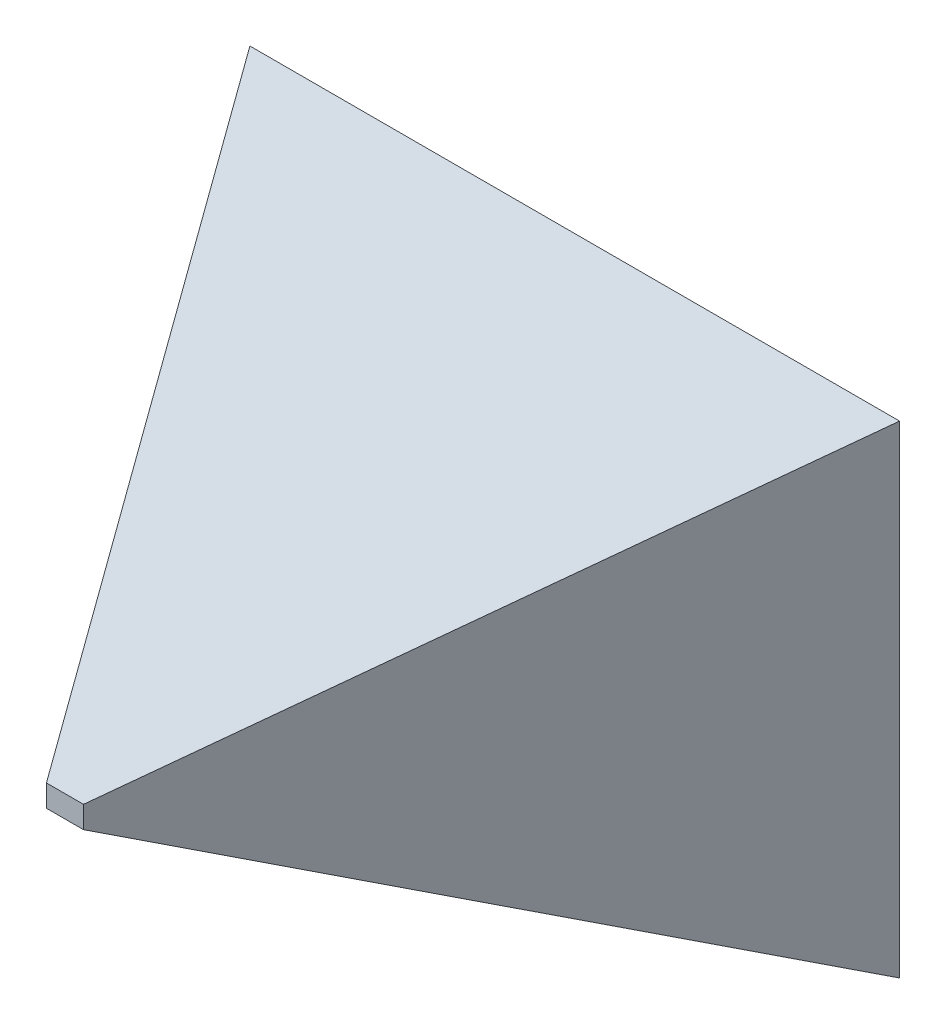
from build123d import *

# Parameters (mm, degrees)
SKETCH1_W               = 1019.556
SKETCH1_H               = 756.92
BOSS_EXTRUDE1_DEPTH     = 800
CUT_EXTRUDE1_DEPTH      = 1351.083852483
CUT_EXTRUDE2_DEPTH      = 1022.325404014
CUT_EXTRUDE2_DEPTH_BACK = 1022.325404014


with BuildPart() as part:
    # Sketch1 → Boss-Extrude1 (new body)
    with BuildSketch(Plane.XY):
        Rectangle(SKETCH1_W, SKETCH1_H)
    extrude(amount=BOSS_EXTRUDE1_DEPTH)

    # Sketch2 → Cut-Extrude1 (cut, through all)
    with BuildSketch(Plane(origin=(509.778, 0, 0), x_dir=(0, 0, -1), z_dir=(1, 0, 0))):
        Polygon((2016.625671317, 1289.001404615), (0, 378.46), (-838.195987242, 0), (0, -378.46), (2016.625671317, -1289.001404615), (-2408.694542061, -1289.001404615), (-2408.694542061, 1289.001404615), align=None)
    extrude(amount=-CUT_EXTRUDE1_DEPTH, mode=Mode.SUBTRACT)

    # Sketch4 → Cut-Extrude2 (cut, two sides: drawn at the far end of the back side and taken through both)
    with BuildSketch(Plane(origin=(0, 0, 0), x_dir=(1, 0, 0), z_dir=(0, 1, 0)).offset(-CUT_EXTRUDE2_DEPTH_BACK)):
        Polygon((-1849.85876024, 2230.26891396), (-509.778, 0), (0, -848.413065954), (509.778, 0), (1849.85876024, 2230.26891396), (1849.85876024, -2973.543485633), (-1849.85876024, -2973.543485633), align=None)
    extrude(amount=CUT_EXTRUDE2_DEPTH + CUT_EXTRUDE2_DEPTH_BACK, mode=Mode.SUBTRACT)


solid = part.part
